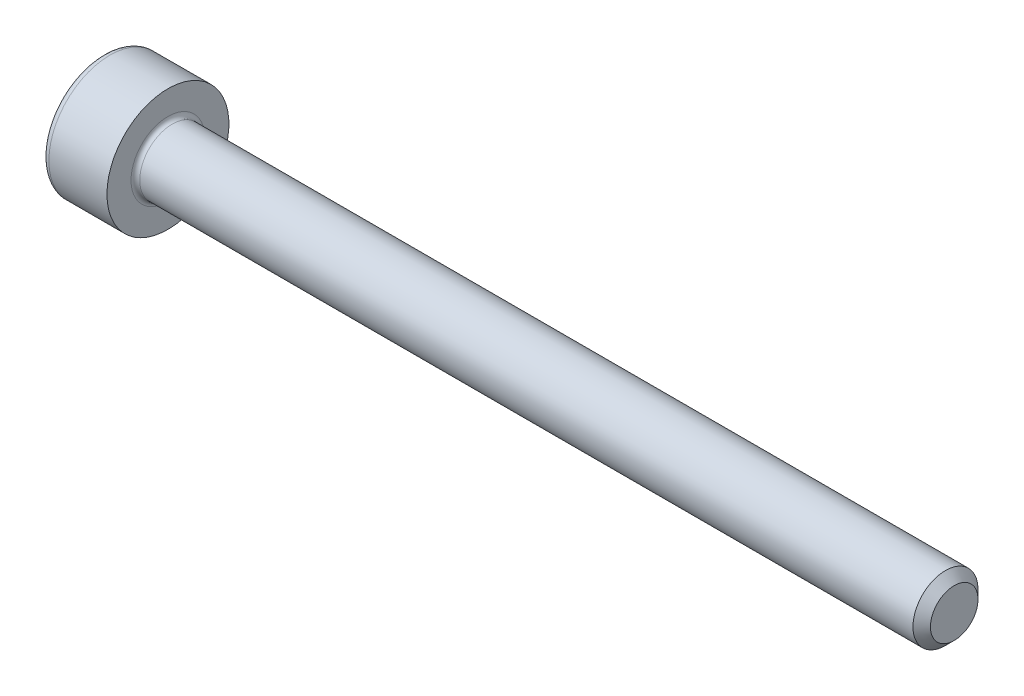
from build123d import *

# Parameters (mm, degrees)
FILLET1_R      = 0.1
FILLET2_R      = 0.16
CHAMFER1_SIZE  = 0.2
EXTRUDE1_DEPTH = 0.7


with BuildPart() as part:
    # Sketch1 → Revolve1 (revolve)
    with BuildSketch(Plane.XY, mode=Mode.PRIVATE) as revolve1_sk:
        Polygon((0, 1.395688245), (0, 0), (19.488734128, 0), (19.488734128, 0.744367064), (1.488734128, 0.744367064), (1.488734128, 1.395688245), align=None)
    revolve(revolve1_sk.sketch.rotate(Axis((0, 0, 0), (1, 0, 0)), 90), axis=Axis((0, 0, 0), (1, 0, 0)))

    # Fillet1
    fillet1_edges = [part.edges().sort_by_distance(p)[0] for p in [
        (1.488734128, 0, -0.744367064),
    ]]
    fillet(fillet1_edges, radius=FILLET1_R)

    # Fillet2
    fillet2_edges = [part.edges().sort_by_distance(p)[0] for p in [
        (0, 0, -1.395688245),
    ]]
    fillet(fillet2_edges, radius=FILLET2_R)

    # Chamfer1
    chamfer1_edges = [part.edges().sort_by_distance(p)[0] for p in [
        (19.488734128, 0, -0.744367064),
    ]]
    chamfer(chamfer1_edges, length=CHAMFER1_SIZE)

    # Sketch2 → Extrude1 (cut)
    with BuildSketch(Plane.ZY):
        Polygon((0, 0.877572409), (-0.76, 0.438786205), (-0.76, -0.438786205), (0, -0.877572409), (0.76, -0.438786205), (0.76, 0.438786205), align=None)
    extrude(amount=-EXTRUDE1_DEPTH, mode=Mode.SUBTRACT)


solid = part.part
